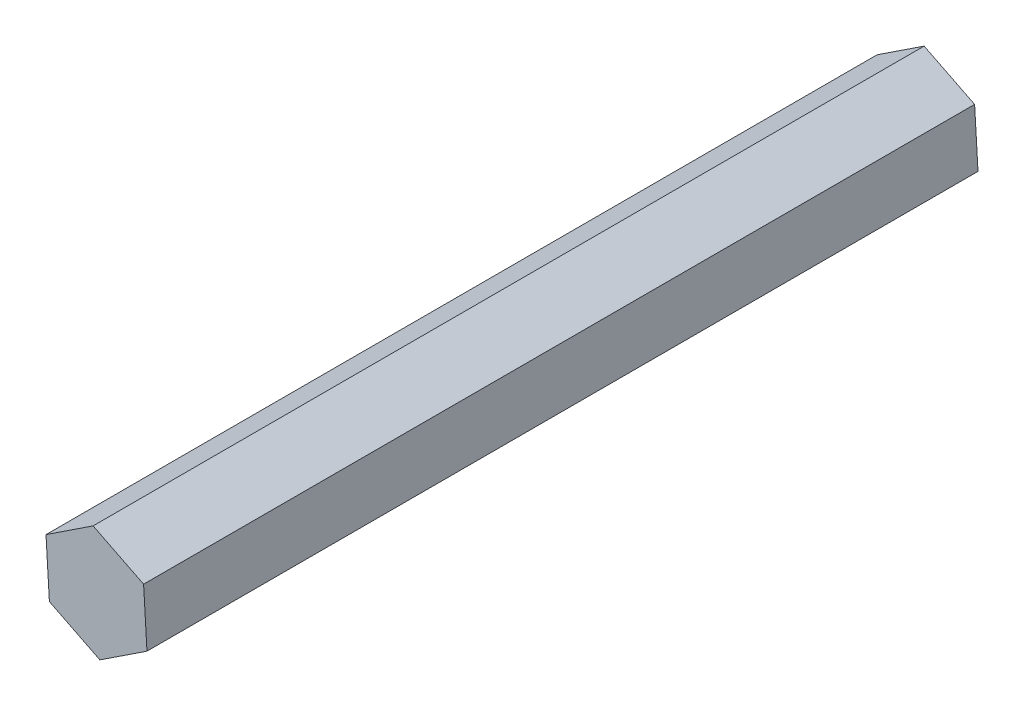
from build123d import *

# Parameters (mm, degrees)
BOSS_EXTRUDE1_DEPTH = 107.95


with BuildPart() as part:
    # Sketch1 → Boss-Extrude1 (new body)
    with BuildSketch(Plane.XY):
        Polygon((-6.5582518, 3.2791259), (-6.118932231, -4.040049713), (0.439319568, -7.319175613), (6.5582518, -3.2791259), (6.118932231, 4.040049713), (-0.439319568, 7.319175613), align=None)
    extrude(amount=BOSS_EXTRUDE1_DEPTH)


solid = part.part
